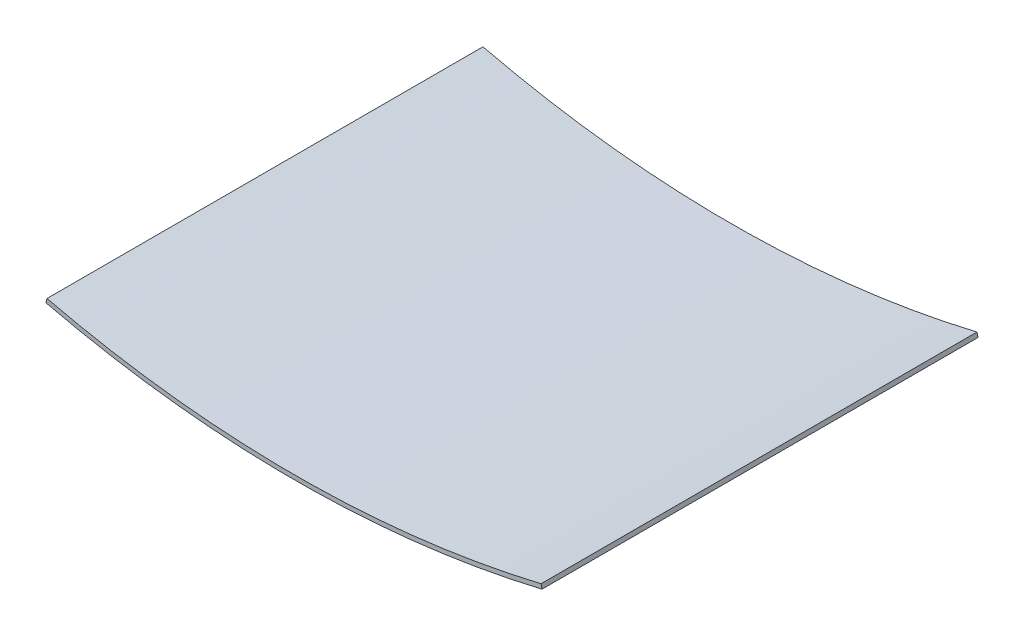
from build123d import *

# Parameters (mm, degrees)
EXTRUDE_THIN1_DEPTH = 381


with BuildPart() as part:
    # Sketch1 → Extrude-Thin1 (new body)
    with BuildSketch(Plane.XY):
        with BuildLine():
            ThreePointArc((-215.9, 25.4), (0, 0), (215.9, 25.4))
            Line((215.9, 25.4), (216.784232082, 21.694027304))
            ThreePointArc((216.784232082, 21.694027304), (0, -3.81), (-216.784232082, 21.694027304))
            Line((-216.784232082, 21.694027304), (-215.9, 25.4))
        make_face()
    extrude(amount=EXTRUDE_THIN1_DEPTH)


solid = part.part
